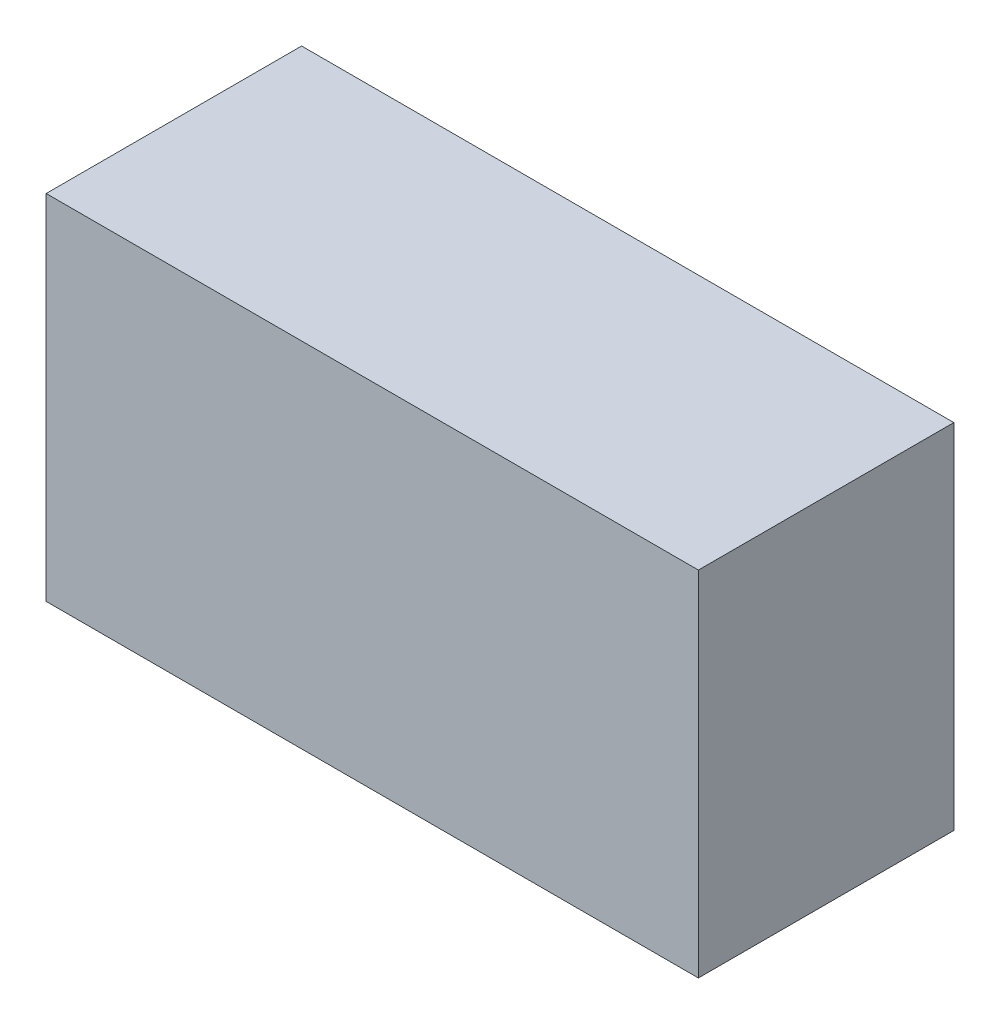
from build123d import *

# Parameters (mm, degrees)
SKETCH1_W           = 60
SKETCH1_H           = 32.5
BOSS_EXTRUDE1_DEPTH = 23.5


with BuildPart() as part:
    # Sketch1 → Boss-Extrude1 (new body)
    with BuildSketch(Plane.XY):
        with Locations((30, 16.25)):
            Rectangle(SKETCH1_W, SKETCH1_H)
    extrude(amount=BOSS_EXTRUDE1_DEPTH)


solid = part.part
